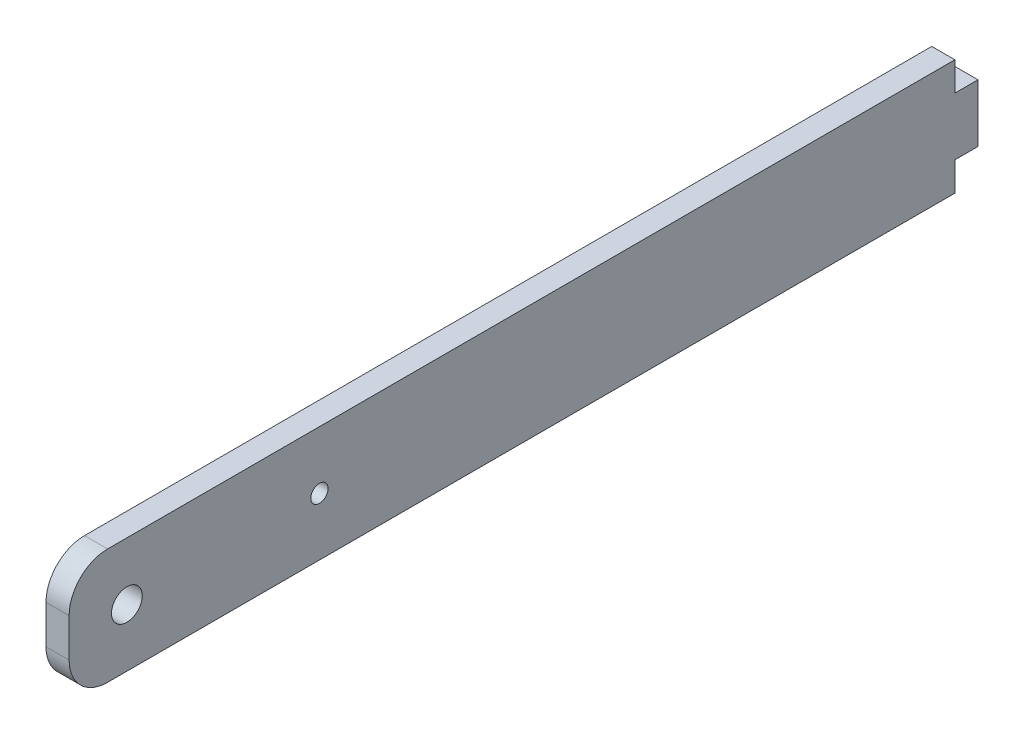
from build123d import *

# Parameters (mm, degrees)
CROQUIS2_W                   = 230
CROQUIS2_H                   = 30
CROQUIS2_R                   = 4
SALIENTE_EXTRUIR1_DEPTH      = 3
TALADRO_DE_MARGEN_PARA_M41_D = 4.5
REDONDEO1_R                  = 10
CROQUIS5_W                   = 6
CROQUIS5_H                   = 15
SALIENTE_EXTRUIR2_DEPTH      = 6


with BuildPart() as part:
    # Croquis2 → Saliente-Extruir1 (new, symmetric)
    with BuildSketch(Plane(origin=(0, 0, 0), x_dir=(0, 0, -1), z_dir=(1, 0, 0))):
        Rectangle(CROQUIS2_W, CROQUIS2_H)
        with Locations((-100, 0)):
            Circle(CROQUIS2_R, mode=Mode.SUBTRACT)
    extrude(amount=SALIENTE_EXTRUIR1_DEPTH, both=True)

    # Taladro de margen para M41 (through all)
    with Locations(Plane(origin=(3, 0, 0), x_dir=(0, 0, -1), z_dir=(1, 0, 0))):
        with Locations((-50, 0)):
            Hole(TALADRO_DE_MARGEN_PARA_M41_D / 2)

    # Redondeo1
    redondeo1_edges = [part.edges().sort_by_distance(p)[0] for p in [
        (0, 15, 115),
        (0, -15, 115),
    ]]
    fillet(redondeo1_edges, radius=REDONDEO1_R)

    # Croquis5 → Saliente-Extruir2 (add, through all)
    with BuildSketch(Plane(origin=(3, 0, 0), x_dir=(0, 0, -1), z_dir=(1, 0, 0))):
        with Locations((118, 0)):
            Rectangle(CROQUIS5_W, CROQUIS5_H)
    extrude(amount=-SALIENTE_EXTRUIR2_DEPTH)


solid = part.part
